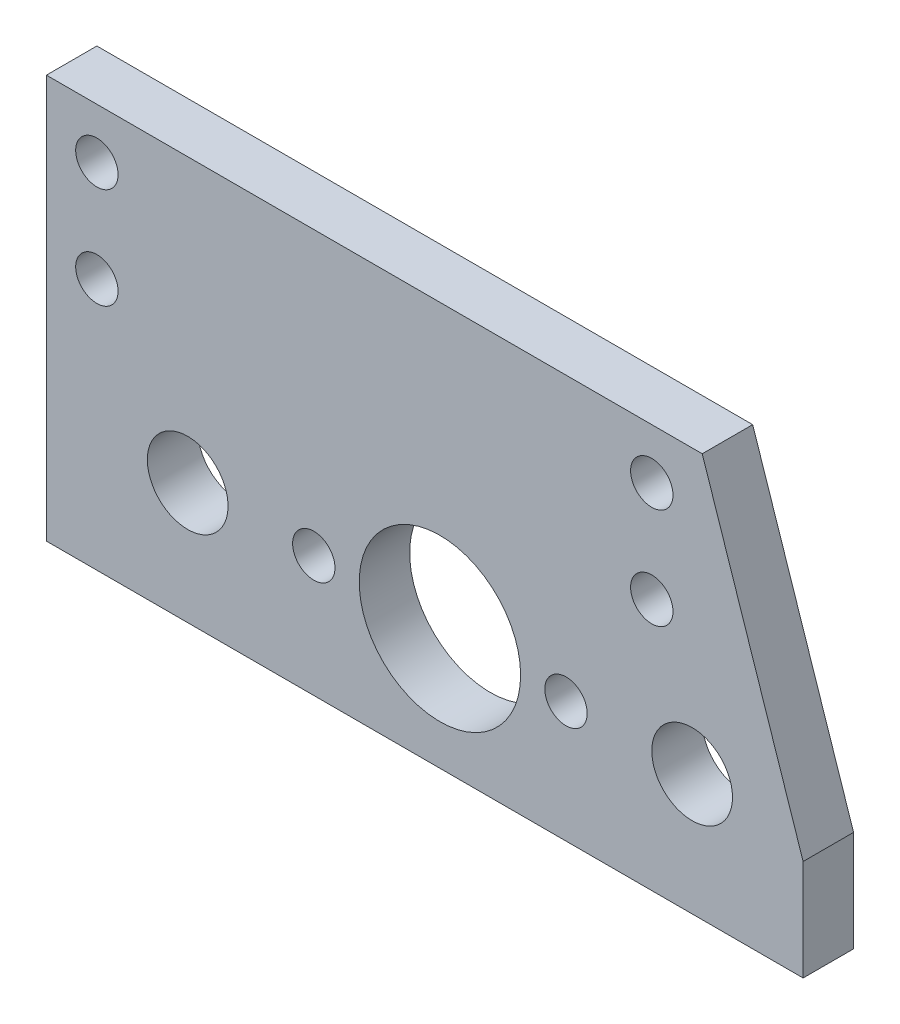
from build123d import *

# Parameters (mm, degrees)
SKETCH1_R           = 2.1
SKETCH1_R_2         = 4
SKETCH1_R_3         = 8
BOSS_EXTRUDE1_DEPTH = 5


with BuildPart() as part:
    # Sketch1 → Boss-Extrude1 (new body)
    with BuildSketch(Plane.XY):
        Polygon((124.111470678, 15.338509317), (59.111470678, 15.338509317), (59.111470678, -6.661490683), (59.111470678, -24.661490683), (124.111470678, -24.661490683), (134.111470678, -24.661490683), (134.111470678, -14.661490683), align=None)
        with Locations((64.111470678, 10.338509317)):
            Circle(SKETCH1_R, mode=Mode.SUBTRACT)
        with Locations((119.111470678, 10.338509317)):
            Circle(SKETCH1_R, mode=Mode.SUBTRACT)
        with Locations((64.111470678, 0.338509317)):
            Circle(SKETCH1_R, mode=Mode.SUBTRACT)
        with Locations((119.111470678, 0.338509317)):
            Circle(SKETCH1_R, mode=Mode.SUBTRACT)
        with Locations((123.111470678, -12.661490683)):
            Circle(SKETCH1_R_2, mode=Mode.SUBTRACT)
        with Locations((98.111470678, -12.661490683)):
            Circle(SKETCH1_R_3, mode=Mode.SUBTRACT)
        with Locations((85.611470678, -12.661490683)):
            Circle(SKETCH1_R, mode=Mode.SUBTRACT)
        with Locations((110.611470678, -12.661490683)):
            Circle(SKETCH1_R, mode=Mode.SUBTRACT)
        with Locations(Location((73.111470678, -12.661490683, 0), (0, 0, 180))):
            Circle(SKETCH1_R_2, mode=Mode.SUBTRACT)
    extrude(amount=BOSS_EXTRUDE1_DEPTH)


solid = part.part
